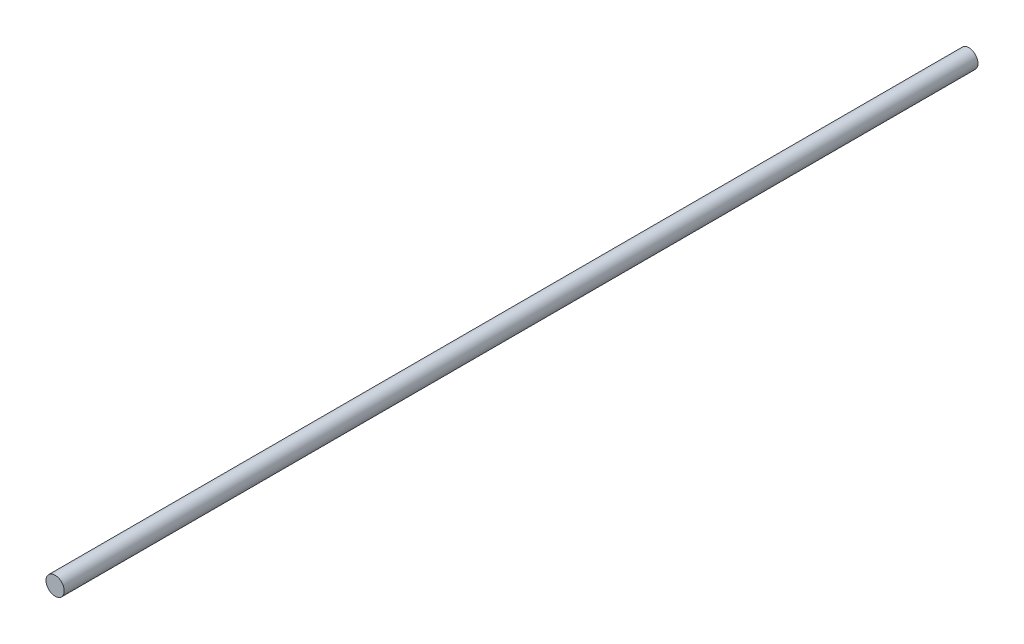
from build123d import *

# Parameters (mm, degrees)
SKETCH_1_W = 3.4
SKETCH_1_H = 340


with BuildPart() as part:
    # Эскиз1 → Повернуть1 (revolve)
    with BuildSketch(Plane(origin=(0, 0, 0), x_dir=(1, 0, 0), z_dir=(0, 1, 0))):
        with Locations((1.7, -170)):
            Rectangle(SKETCH_1_W, SKETCH_1_H)
    revolve(axis=Axis((0, 0, 0), (0, 0, 1)))


solid = part.part
